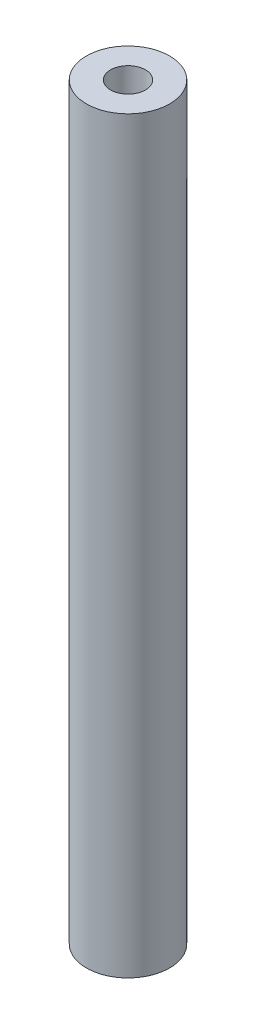
from build123d import *

# Parameters (mm, degrees)
SKETCH2_R           = 5
BOSS_EXTRUDE1_DEPTH = 90
SKETCH3_R           = 2.1
CUT_EXTRUDE1_DEPTH  = 91.277350426


with BuildPart() as part:
    # Sketch2 → Boss-Extrude1 (new body)
    with BuildSketch(Plane(origin=(0, 0, 0), x_dir=(1, 0, 0), z_dir=(0, 1, 0))):
        Circle(SKETCH2_R)
    extrude(amount=BOSS_EXTRUDE1_DEPTH)

    # Sketch3 → Cut-Extrude1 (cut, through all)
    with BuildSketch(Plane(origin=(0, 90, 0), x_dir=(1, 0, 0), z_dir=(0, 1, 0))):
        Circle(SKETCH3_R)
    extrude(amount=-CUT_EXTRUDE1_DEPTH, mode=Mode.SUBTRACT)


solid = part.part
